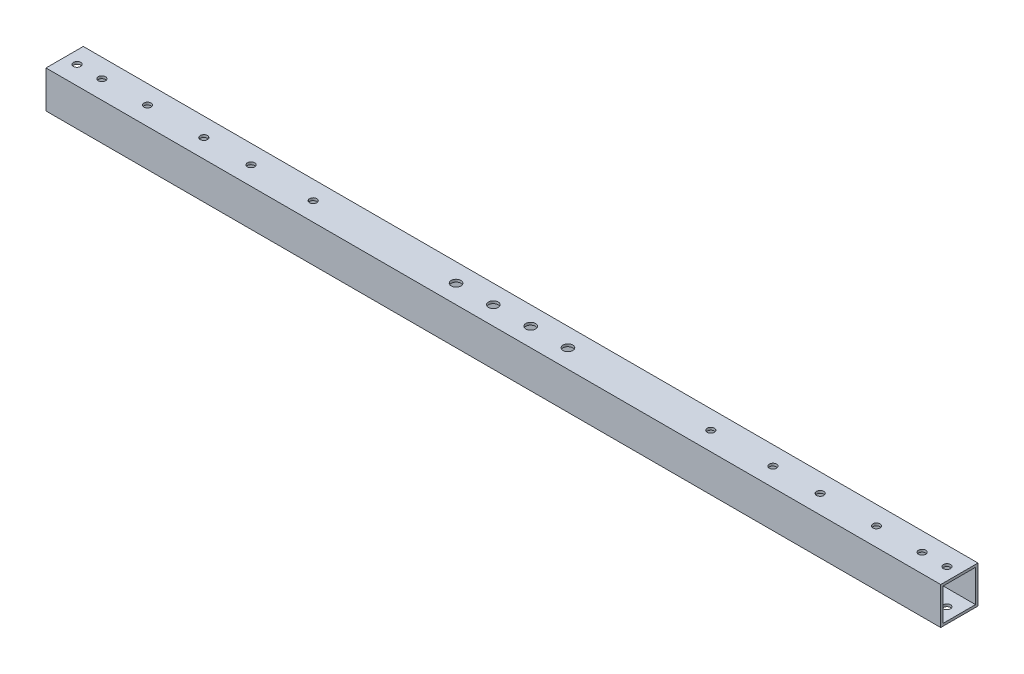
from build123d import *

# Parameters (mm, degrees)
SKETCH_1_W          = 15
SKETCH_1_H          = 15
SKETCH_1_W_2        = 13
SKETCH_1_H_2        = 13
EXTRUDE_1_DEPTH     = 360
SKETCH_2_R          = 1.45
SKETCH_2_R_2        = 1.95
CUT_EXTRUDE_1_DEPTH = 361.390413302


with BuildPart() as part:
    # 草图1 → 凸台-拉伸1 (new body)
    with BuildSketch(Plane(origin=(0, 0, 0), x_dir=(0, 0, -1), z_dir=(1, 0, 0))):
        Rectangle(SKETCH_1_W, SKETCH_1_H)
        Rectangle(SKETCH_1_W_2, SKETCH_1_H_2, mode=Mode.SUBTRACT)
    extrude(amount=EXTRUDE_1_DEPTH)

    # 草图2 → 切除-拉伸1 (cut, through all)
    with BuildSketch(Plane.XZ.offset(7.5)):
        with Locations(Location((355, 0, 0), (0, 0, 270))):
            Circle(SKETCH_2_R)
        with Locations(Location((345, 0, 0), (0, 0, 270))):
            Circle(SKETCH_2_R)
        with Locations(Location((285, 0, 0), (0, 0, 270))):
            Circle(SKETCH_2_R)
        with Locations(Location((260, 0, 0), (0, 0, 270))):
            Circle(SKETCH_2_R)
        with Locations(Location((202.5, 0, 0), (0, 0, 270))):
            Circle(SKETCH_2_R_2)
        with Locations(Location((187.5, 0, 0), (0, 0, 270))):
            Circle(SKETCH_2_R_2)
        with Locations(Location((172.5, 0, 0), (0, 0, 270))):
            Circle(SKETCH_2_R_2)
        with Locations(Location((157.5, 0, 0), (0, 0, 270))):
            Circle(SKETCH_2_R_2)
        with Locations(Location((100, 0, 0), (0, 0, 270))):
            Circle(SKETCH_2_R)
        with Locations(Location((75, 0, 0), (0, 0, 270))):
            Circle(SKETCH_2_R)
        with Locations(Location((15, 0, 0), (0, 0, 270))):
            Circle(SKETCH_2_R)
        with Locations(Location((5, 0, 0), (0, 0, 270))):
            Circle(SKETCH_2_R)
        with Locations(Location((33.354101966, -0.00151519, 0), (0, 0, 270))):
            Circle(SKETCH_2_R)
        with Locations(Location((326.645898034, -0.00151519, 0), (0, 0, 270))):
            Circle(SKETCH_2_R)
        with Locations(Location((56, 0, 0), (0, 0, 270))):
            Circle(SKETCH_2_R)
        with Locations(Location((304, 0, 0), (0, 0, 270))):
            Circle(SKETCH_2_R)
    extrude(amount=-CUT_EXTRUDE_1_DEPTH, mode=Mode.SUBTRACT)


solid = part.part
